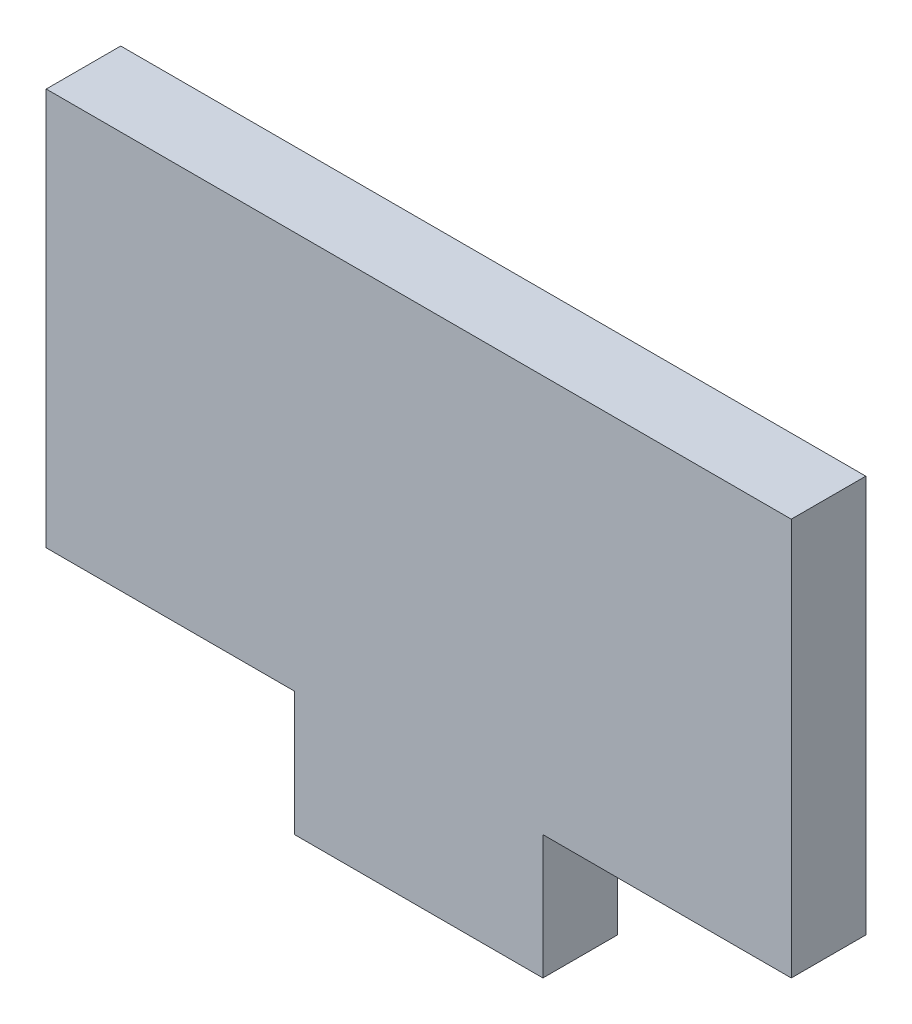
from build123d import *

# Parameters (mm, degrees)
SKETCH1_W           = 30
SKETCH1_H           = 21
BOSS_EXTRUDE1_DEPTH = 3
SKETCH3_W           = 10
SKETCH3_H           = 5
CUT_EXTRUDE1_DEPTH  = 3


with BuildPart() as part:
    # Sketch1 → Boss-Extrude1 (new body)
    with BuildSketch(Plane.XY):
        Rectangle(SKETCH1_W, SKETCH1_H)
    extrude(amount=BOSS_EXTRUDE1_DEPTH)

    # Sketch3 → Cut-Extrude1 (cut)
    with BuildSketch(Plane.XY.offset(3)):
        with Locations((-10, -8)):
            Rectangle(SKETCH3_W, SKETCH3_H)
        with Locations((10, -8)):
            Rectangle(SKETCH3_W, SKETCH3_H)
    extrude(amount=-CUT_EXTRUDE1_DEPTH, mode=Mode.SUBTRACT)


solid = part.part
